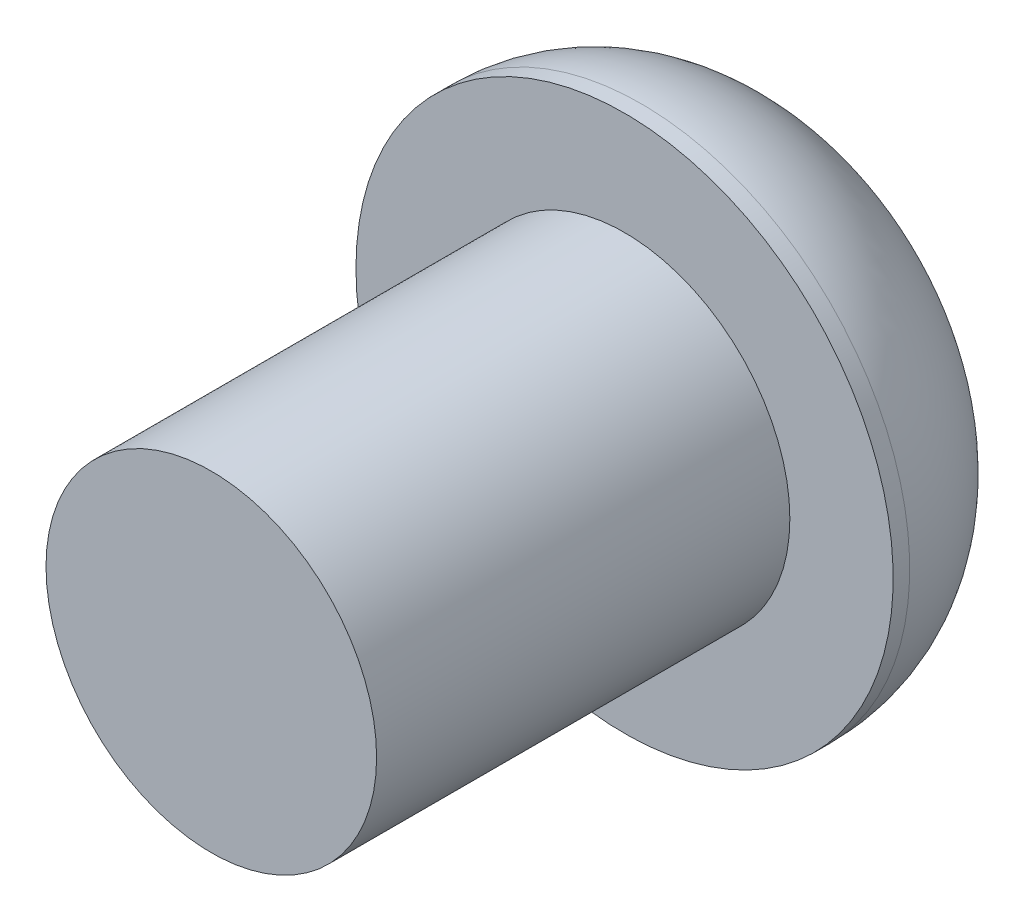
from build123d import *

# Parameters (mm, degrees)
SKETCH_1_R          = 2
EXTRUDE_1_DEPTH     = 5
SKETCH_2_R          = 3.25
EXTRUDE_2_DEPTH     = 2.2
FILLET_1_R          = 2
CUT_EXTRUDE_1_DEPTH = 0.5


with BuildPart() as part:
    # 草图1 → 凸台-拉伸1 (new body)
    with BuildSketch(Plane.XY):
        Circle(SKETCH_1_R)
    extrude(amount=EXTRUDE_1_DEPTH)

    # 草图2 → 凸台-拉伸2 (add)
    with BuildSketch(Plane(origin=(0, 0, 0), x_dir=(-1, 0, 0), z_dir=(0, 0, -1))):
        Circle(SKETCH_2_R)
    extrude(amount=EXTRUDE_2_DEPTH)

    # 圆角1
    fillet_1_edges = [part.edges().sort_by_distance(p)[0] for p in [
        (3.25, 0, -2.2),
    ]]
    fillet(fillet_1_edges, radius=FILLET_1_R)

    # 草图3 → 切除-拉伸1 (cut)
    with BuildSketch(Plane(origin=(0, 0, -2.2), x_dir=(-1, 0, 0), z_dir=(0, 0, -1))):
        Polygon((3.239974874, 0.25), (3.239974874, -0.25), (0.25, -0.25), (0.25, -3.239974874), (-0.25, -3.239974874), (-0.25, -0.25), (-3.239974874, -0.25), (-3.239974874, 0.25), (-0.25, 0.25), (-0.25, 3.239974874), (0.25, 3.239974874), (0.25, 0.25), align=None)
    extrude(amount=-CUT_EXTRUDE_1_DEPTH, mode=Mode.SUBTRACT)


solid = part.part
